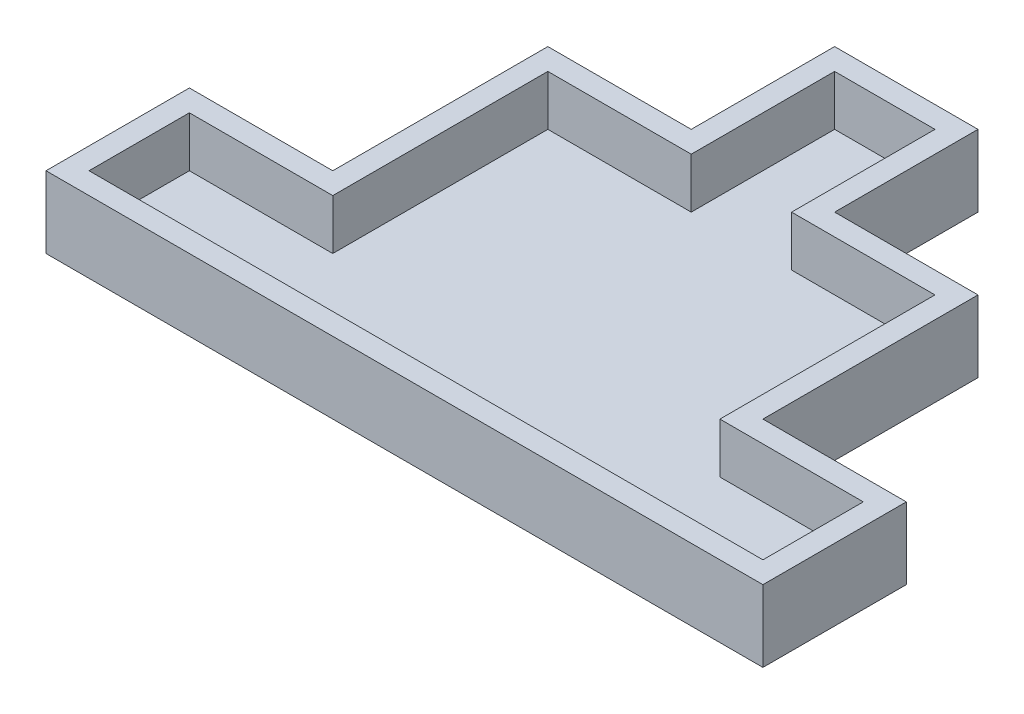
from build123d import *

# Parameters (mm, degrees)
BOSS_EXTRUDE1_DEPTH = 15
SHELL2_T            = -4.5


with BuildPart() as part:
    # Sketch1 → Boss-Extrude1 (new body)
    with BuildSketch(Plane(origin=(0, 0, 0), x_dir=(1, 0, 0), z_dir=(0, 1, 0))):
        Polygon((75, 0), (-75, 0), (-75, 30), (-45, 30), (-45, 75), (-15, 75), (-15, 105), (15, 105), (15, 75), (45, 75), (45, 30), (75, 30), align=None)
    extrude(amount=BOSS_EXTRUDE1_DEPTH)

    # Shell2
    shell2_openings = [part.faces().sort_by_distance(p)[0] for p in [
        (0, 15, -38.214285714),
    ]]
    offset(amount=SHELL2_T, openings=shell2_openings, kind=Kind.INTERSECTION)


solid = part.part
